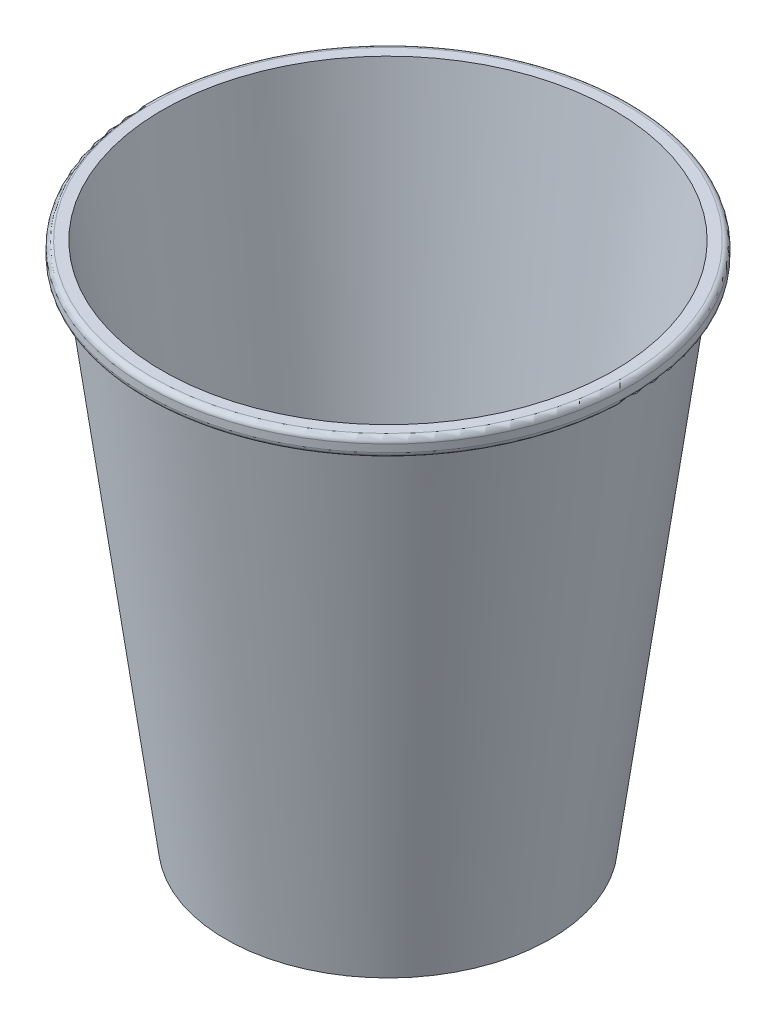
from build123d import *

# Parameters (mm, degrees)
REDONDEO1_R = 1


with BuildPart() as part:
    # Croquis1 → Revolución1 (revolve)
    with BuildSketch(Plane.XY, mode=Mode.PRIVATE) as revoluci_n1_sk:
        Polygon((30.208580675, 0), (42.5622217, 94.1), (45, 94.1), (45, 97.5), (42, 97.5), (30.184615385, 7.5), (0, 7.5), (0, 6.5), (30.053333333, 6.5), (29.2, 0), align=None)
    revolve(revoluci_n1_sk.sketch.rotate(Axis((0, 0, 0), (0, 1, 0)), 90), axis=Axis((0, 0, 0), (0, 1, 0)))

    # Redondeo1
    redondeo1_edges = [part.edges().sort_by_distance(p)[0] for p in [
        (0, 97.5, 45),
        (0, 94.1, 45),
    ]]
    fillet(redondeo1_edges, radius=REDONDEO1_R)


solid = part.part
